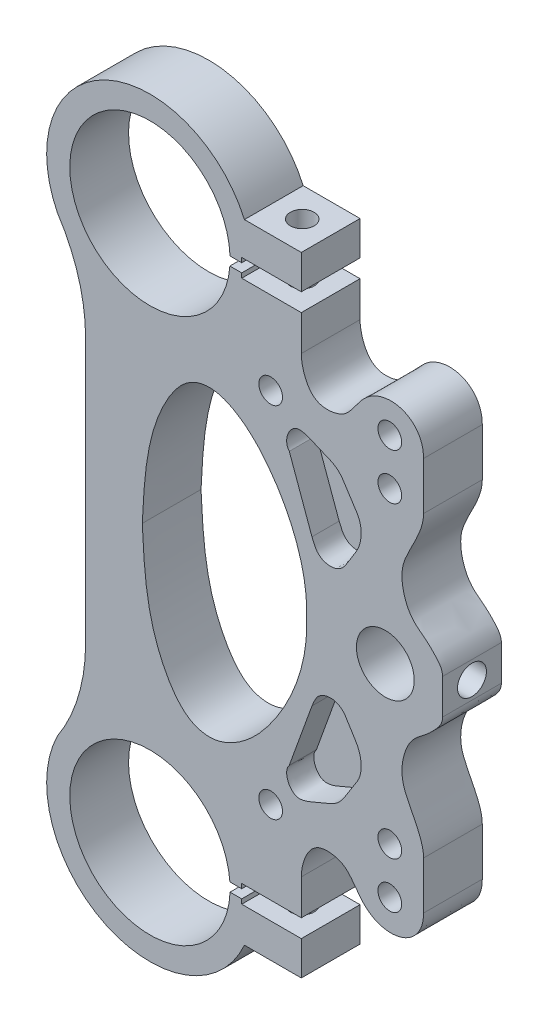
from build123d import *

# Parameters (mm, degrees)
SCHIZZO1_R                     = 2.5
ESTRUSIONE_ESTRUSIONE1_DEPTH   = 5.08
TAGLIO_ESTRUSIONE1_DEPTH       = 2.35
FORO_FILETTATO_M2_5X0_45_1_D   = 2.05
FORO_FILETTATO_M3X0_5_1_REACH  = 80.829
FORO_FILETTATO_M3X0_5_1_BORE_R = 1.25


with BuildPart() as part:
    # Schizzo1 → Estrusione-Estrusione1 (new body)
    with BuildSketch(Plane.XY):
        with BuildLine():
            Line((10.78299118, 49.780959651), (10.78299118, 26.898787325))
            ThreePointArc((10.78299118, 26.898787325), (10.339487436, 23.297689716), (9.035482204, 19.911811705))
            ThreePointArc((9.035482204, 19.911811705), (8.70291473, 19.32141597), (8.343745321, 18.7468156))
            ThreePointArc((8.343745321, 18.7468156), (12.559578595, 6.695692747), (24.514917355, 11.175948023))
            Line((24.514917355, 11.175948023), (29.432282014, 11.175948023))
            Line((29.432282014, 11.175948023), (29.432282014, 14.125948023))
            Line((29.432282014, 14.125948023), (24.282282014, 14.125948023))
            Line((24.282282014, 14.125948023), (24.282282014, 14.525948023))
            Line((24.282282014, 14.525948023), (23.271153051, 14.525948023))
            ThreePointArc((23.271153051, 14.525948023), (9.416981792, 14.662564542), (23.257993682, 15.281527553))
            Line((23.257993682, 15.281527553), (24.282282014, 15.281527553))
            Line((24.282282014, 15.281527553), (24.282282014, 15.681527553))
            Line((24.282282014, 15.681527553), (29.432282014, 15.681527553))
            Line((29.432282014, 15.681527553), (29.432282014, 18.7468156))
            add(Edge.make_bspline(
                [(40.000786153, 21.320769203), (40.000786153, 20.876213518), (39.839651949, 19.914885346), (38.762197399, 18.644551924), (36.941508917, 18.231975362), (35.074368134, 18.961905605), (34.141140628, 20.300851978), (33.28691486, 21.432930151), (32.119127395, 21.874346007), (30.805160818, 21.803097176), (29.707689334, 20.633708437), (29.432282014, 19.334363976), (29.432282014, 18.7468156)],
                knots=[0, 0, 0, 0, 0.086234691, 0.184609734, 0.306359642, 0.425659046, 0.552279169, 0.620029594, 0.697313826, 0.787230994, 0.856419624, 1, 1, 1, 1], degree=3))
            Line((40.000786153, 21.320769203), (40.000786153, 25.445392669))
            add(Edge.make_bspline(
                [(40.000786153, 25.445392669), (40.000786153, 25.908735086), (39.721698855, 27.023685395), (38.903788121, 28.56022153), (38.037940745, 30.310367093), (38.174753721, 32.240407679), (38.902713905, 33.860511177), (40.120028186, 34.693284663), (41.042554679, 35.552536639), (41.648042989, 36.283627884), (41.648042989, 36.817827012)],
                knots=[0, 0, 0, 0, 0.103904192, 0.266699661, 0.404029281, 0.548278207, 0.701667575, 0.797389079, 0.884226966, 1, 1, 1, 1], degree=3))
            Line((41.648042989, 36.817827012), (41.648042989, 39.861919964))
            add(Edge.make_bspline(
                [(40.000786153, 51.234354306), (40.000786153, 50.77101189), (39.721698855, 49.65606158), (38.903788121, 48.119525445), (38.037940745, 46.369379882), (38.174753721, 44.439339296), (38.902713905, 42.819235798), (40.120028186, 41.986462312), (41.042554679, 41.127210336), (41.648042989, 40.396119091), (41.648042989, 39.861919964)],
                knots=[0, 0, 0, 0, 0.103904192, 0.266699661, 0.404029281, 0.548278207, 0.701667575, 0.797389079, 0.884226966, 1, 1, 1, 1], degree=3))
            Line((40.000786153, 51.234354306), (40.000786153, 55.358977772))
            add(Edge.make_bspline(
                [(40.000786153, 55.358977772), (40.000786153, 55.803533457), (39.839651949, 56.764861629), (38.762197399, 58.035195052), (36.941508917, 58.447771613), (35.074368134, 57.717841371), (34.141140628, 56.378894997), (33.28691486, 55.246816824), (32.119127395, 54.805400968), (30.805160818, 54.876649799), (29.707689334, 56.046038538), (29.432282014, 57.345382999), (29.432282014, 57.932931375)],
                knots=[0, 0, 0, 0, 0.086234691, 0.184609734, 0.306359642, 0.425659046, 0.552279169, 0.620029594, 0.697313826, 0.787230994, 0.856419624, 1, 1, 1, 1], degree=3))
            Line((29.432282014, 57.932931375), (29.432282014, 60.998219422))
            Line((29.432282014, 60.998219422), (24.282282014, 60.998219422))
            Line((24.282282014, 60.998219422), (24.282282014, 61.398219422))
            Line((24.282282014, 61.398219422), (23.257993682, 61.398219422))
            ThreePointArc((23.257993682, 61.398219422), (9.416981792, 62.017182434), (23.271153051, 62.153798952))
            Line((23.271153051, 62.153798952), (24.282282014, 62.153798952))
            Line((24.282282014, 62.153798952), (24.282282014, 62.553798952))
            Line((24.282282014, 62.553798952), (29.432282014, 62.553798952))
            Line((29.432282014, 62.553798952), (29.432282014, 65.503798952))
            Line((29.432282014, 65.503798952), (24.514917355, 65.503798952))
            ThreePointArc((24.514917355, 65.503798952), (12.559578595, 69.984054228), (8.343745321, 57.932931375))
            ThreePointArc((8.343745321, 57.932931375), (8.70291473, 57.358331006), (9.035482204, 56.767935271))
            ThreePointArc((9.035482204, 56.767935271), (10.339487436, 53.382057259), (10.78299118, 49.780959651))
        make_face()
        with BuildLine():
            add(Edge.make_bspline(
                [(15.682597142, 38.339873488), (15.862127321, 34.83902794), (16.076956788, 30.195397892), (19.436029343, 25.500544959), (22.003237557, 25.120656017), (24.462992199, 26.161428979), (27.017677892, 28.909232559), (29.309944893, 33.118967607), (29.972256674, 36.502062861), (29.886078718, 38.339873488)],
                knots=[0, 0, 0, 0, 0.321954935, 0.444159149, 0.483908226, 0.555795087, 0.68318302, 0.828712277, 1, 1, 1, 1], degree=3))
            add(Edge.make_bspline(
                [(15.682597142, 38.339873488), (15.862127321, 41.840719035), (16.076956788, 46.484349083), (19.436029343, 51.179202017), (22.003237557, 51.559090959), (24.462992199, 50.518317996), (27.017677892, 47.770514416), (29.309944893, 43.560779368), (29.972256674, 40.177684115), (29.886078718, 38.339873488)],
                knots=[0, 0, 0, 0, 0.321954935, 0.444159149, 0.483908226, 0.555795087, 0.68318302, 0.828712277, 1, 1, 1, 1], degree=3))
        make_face(mode=Mode.SUBTRACT)
        with Locations((36.696640264, 38.339873488)):
            Circle(SCHIZZO1_R, mode=Mode.SUBTRACT)
    extrude(amount=ESTRUSIONE_ESTRUSIONE1_DEPTH)

    # Schizzo2 → Taglio-Estrusione1 (cut)
    with BuildSketch(Plane.XY.offset(5.08)):
        with BuildLine():
            Line((28.391525021, 50.0978395), (30.353168063, 44.671476279))
            add(Edge.make_bspline(
                [(28.391525021, 50.0978395), (27.85941667, 50.70483352), (28.469228552, 52.318625392), (30.028576321, 52.052630421), (31.113122257, 51.481849946), (32.355694438, 51.101396326), (33.193026443, 50.147391254), (33.71185739, 49.149700577), (34.537765346, 48.087790645), (34.668060624, 46.883821656), (34.388238335, 45.703691513), (33.640178154, 44.710850874), (33.067102926, 43.535075454), (32.034600726, 43.169994725), (31.283972065, 43.377286139), (30.879406935, 43.685727772), (30.681567817, 43.856219961), (30.353168063, 44.671476279)],
                knots=[0, 0, 0, 0, 0.136840128, 0.175150117, 0.257072058, 0.352961129, 0.390176534, 0.47294284, 0.548010404, 0.617626637, 0.673801368, 0.753612676, 0.832486621, 0.8878174, 0.933329401, 0.944547661, 1, 1, 1, 1], degree=3))
        make_face()
        with BuildLine():
            Line((28.391525021, 26.581907475), (30.353168063, 32.008270697))
            add(Edge.make_bspline(
                [(28.391525021, 26.581907475), (27.85941667, 25.974913456), (28.469228552, 24.361121583), (30.028576321, 24.627116554), (31.113122257, 25.197897029), (32.355694438, 25.57835065), (33.193026443, 26.532355721), (33.71185739, 27.530046399), (34.537765346, 28.59195633), (34.668060624, 29.795925319), (34.388238335, 30.976055462), (33.640178154, 31.968896101), (33.067102926, 33.144671522), (32.034600726, 33.50975225), (31.283972065, 33.302460836), (30.879406935, 32.994019203), (30.681567817, 32.823527014), (30.353168063, 32.008270697)],
                knots=[0, 0, 0, 0, 0.136840128, 0.175150117, 0.257072058, 0.352961129, 0.390176534, 0.47294284, 0.548010404, 0.617626637, 0.673801368, 0.753612676, 0.832486621, 0.8878174, 0.933329401, 0.944547661, 1, 1, 1, 1], degree=3))
        make_face()
    extrude(amount=-TAGLIO_ESTRUSIONE1_DEPTH, mode=Mode.SUBTRACT)

    # Foro filettato M2.5x0.45-1 (through all)
    with Locations(Plane.XY.offset(5.08)):
        with Locations((37.08299118, 25.039873488), (37.08299118, 21.039873488), (26.78299118, 22.839873488), (26.78299118, 53.839873488), (37.08299118, 55.639873488), (37.08299118, 51.639873488)):
            Hole(FORO_FILETTATO_M2_5X0_45_1_D / 2)

    # Foro filettato M3x0.5-1 bore → Foro filettato M3x0.5-1 (cut, up to next)
    with BuildSketch(Plane(origin=(41.648042989, 0, 0), x_dir=(0, 0, -1), z_dir=(1, 0, 0)), mode=Mode.PRIVATE) as foro_filettato_m3x0_5_1_sk1:
        with Locations((-2.54, 38.339873488)):
            Circle(FORO_FILETTATO_M3X0_5_1_BORE_R)
    foro_filettato_m3x0_5_1_tool1 = extrude(foro_filettato_m3x0_5_1_sk1.sketch, amount=-FORO_FILETTATO_M3X0_5_1_REACH, mode=Mode.PRIVATE) & part.part
    add(foro_filettato_m3x0_5_1_tool1.solids().sort_by_distance((41.648043, 38.339873, 2.54))[0], mode=Mode.SUBTRACT)

    # Schizzo7 → Foro filettato M2.5x0.45-2 (revolve, cut)
    with BuildSketch(Plane(origin=(26.973599685, 65.503798952, 2.54), x_dir=(0, 0, 1), z_dir=(1, 0, 0))):
        Polygon((0, 0), (0, 10.615882135), (1.025, 10), (1.025, 0), align=None)
    foro_filettato_m2_5x0_45_2 = revolve(axis=Axis((26.973599685, 71.853798952, 2.54), (0, -1, 0)), mode=Mode.SUBTRACT)

    # Specchia1: Foro filettato M2.5x0.45-2 across plane
    add(foro_filettato_m2_5x0_45_2.mirror(Plane.ZX.offset(38.339873488)), mode=Mode.SUBTRACT)


solid = part.part
